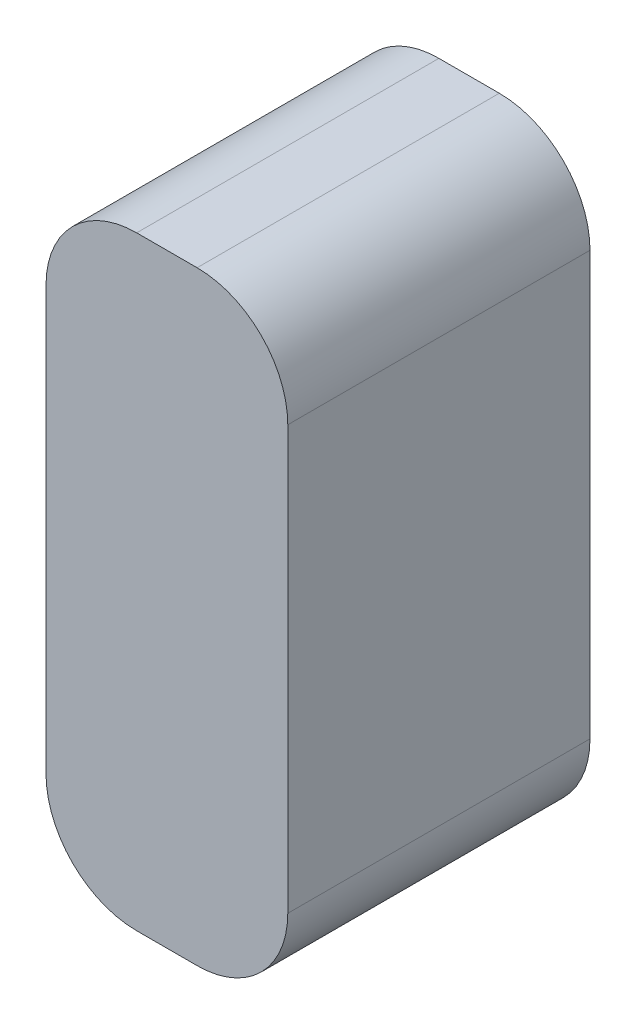
from build123d import *

# Parameters (mm, degrees)
SKETCH1_W           = 8
SKETCH1_H           = 20
BOSS_EXTRUDE1_DEPTH = 10
FILLET1_R           = 3


with BuildPart() as part:
    # Sketch1 → Boss-Extrude1 (new body)
    with BuildSketch(Plane.XY):
        with Locations((0, 289)):
            Rectangle(SKETCH1_W, SKETCH1_H)
    extrude(amount=BOSS_EXTRUDE1_DEPTH)

    # Fillet1
    fillet1_edges = [part.edges().sort_by_distance(p)[0] for p in [
        (-4, 299, 5),
        (4, 299, 5),
        (4, 279, 5),
        (-4, 279, 5),
    ]]
    fillet(fillet1_edges, radius=FILLET1_R)


solid = part.part
